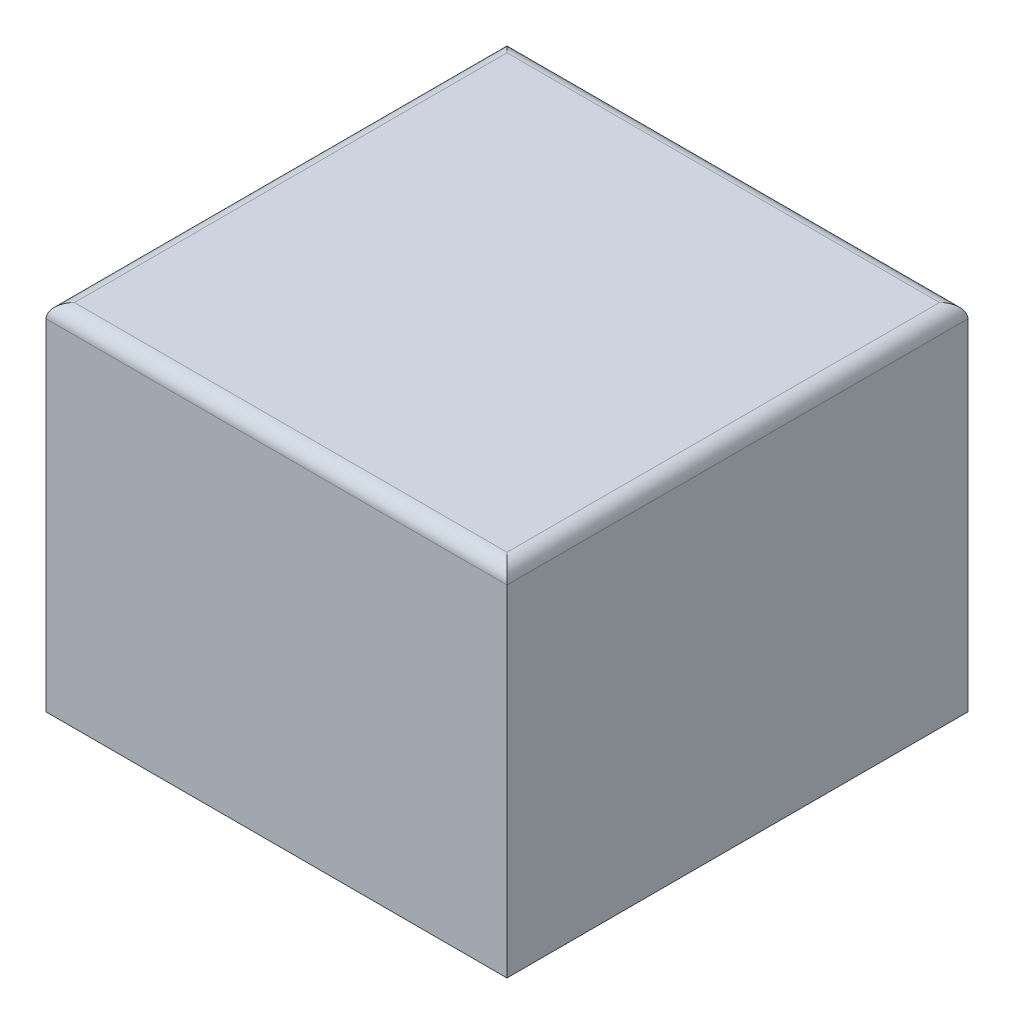
from build123d import *

# Parameters (mm, degrees)
SKETCH1_W           = 26
SKETCH1_H           = 26
BOSS_EXTRUDE1_DEPTH = 8
SKETCH24_W          = 26
SKETCH24_H          = 26
SKETCH24_W_2        = 24.4
SKETCH24_H_2        = 24.4
BOSS_EXTRUDE5_DEPTH = 11.6
SKETCH27_W          = 26
SKETCH27_H          = 26
BOSS_EXTRUDE7_DEPTH = 0.4
FILLET2_R           = 0.8


with BuildPart() as part:
    # Sketch1 → Boss-Extrude1 (new body)
    with BuildSketch(Plane(origin=(0, 0, 0), x_dir=(1, 0, 0), z_dir=(0, 1, 0))):
        Rectangle(SKETCH1_W, SKETCH1_H)
        with BuildLine():
            Line((-4, 7.214142843), (-4, 12.2))
            Line((-4, 12.2), (4, 12.2))
            Line((4, 12.2), (4, 7.214142843))
            ThreePointArc((4, 7.214142843), (8.338477631, 8.338477631), (7.214142843, 4))
            Line((7.214142843, 4), (12.2, 4))
            Line((12.2, 4), (12.2, -4))
            Line((12.2, -4), (7.214142843, -4))
            ThreePointArc((7.214142843, -4), (8.338477631, -8.338477631), (4, -7.214142843))
            Line((4, -7.214142843), (4, -12.2))
            Line((4, -12.2), (-4, -12.2))
            Line((-4, -12.2), (-4, -7.214142843))
            ThreePointArc((-4, -7.214142843), (-8.338477631, -8.338477631), (-7.214142843, -4))
            Line((-7.214142843, -4), (-12.2, -4))
            Line((-12.2, -4), (-12.2, 4))
            Line((-12.2, 4), (-7.214142843, 4))
            ThreePointArc((-7.214142843, 4), (-8.338477631, 8.338477631), (-4, 7.214142843))
        make_face(mode=Mode.SUBTRACT)
    extrude(amount=BOSS_EXTRUDE1_DEPTH)

    # Sketch21 → Cut-Loft5 section 0
    with BuildSketch(Plane(origin=(0, 1, 0), x_dir=(1, 0, 0), z_dir=(0, 1, 0))):
        with BuildLine():
            Line((-7.5, -7.5), (7.5, -7.5))
            Line((7.5, -7.5), (7.5, 7.5))
            Line((7.5, 7.5), (-7.5, 7.5))
            Line((-7.5, 7.5), (-7.5, -7.5))
        make_face()
    # Sketch22 → Cut-Loft5 section 1
    with BuildSketch(Plane(origin=(0, 8, 0), x_dir=(1, 0, 0), z_dir=(0, 1, 0))):
        with BuildLine():
            Line((-12.2, -12.2), (12.2, -12.2))
            Line((12.2, -12.2), (12.2, 12.2))
            Line((12.2, 12.2), (-12.2, 12.2))
            Line((-12.2, 12.2), (-12.2, -12.2))
        make_face()
    loft(mode=Mode.SUBTRACT)

    # Sketch24 → Boss-Extrude5 (add)
    with BuildSketch(Plane(origin=(0, 8, 0), x_dir=(1, 0, 0), z_dir=(0, 1, 0))):
        Rectangle(SKETCH24_W, SKETCH24_H)
        Rectangle(SKETCH24_W_2, SKETCH24_H_2, mode=Mode.SUBTRACT)
    extrude(amount=BOSS_EXTRUDE5_DEPTH)

    # Sketch27 → Boss-Extrude7 (add)
    with BuildSketch(Plane(origin=(0, 19.6, 0), x_dir=(1, 0, 0), z_dir=(0, 1, 0))):
        Rectangle(SKETCH27_W, SKETCH27_H)
    extrude(amount=BOSS_EXTRUDE7_DEPTH)

    # Fillet2
    fillet2_edges = [part.edges().sort_by_distance(p)[0] for p in [
        (13, 20, 0),
        (0, 20, -13),
        (-13, 20, 0),
        (0, 20, 13),
    ]]
    fillet(fillet2_edges, radius=FILLET2_R)


solid = part.part
